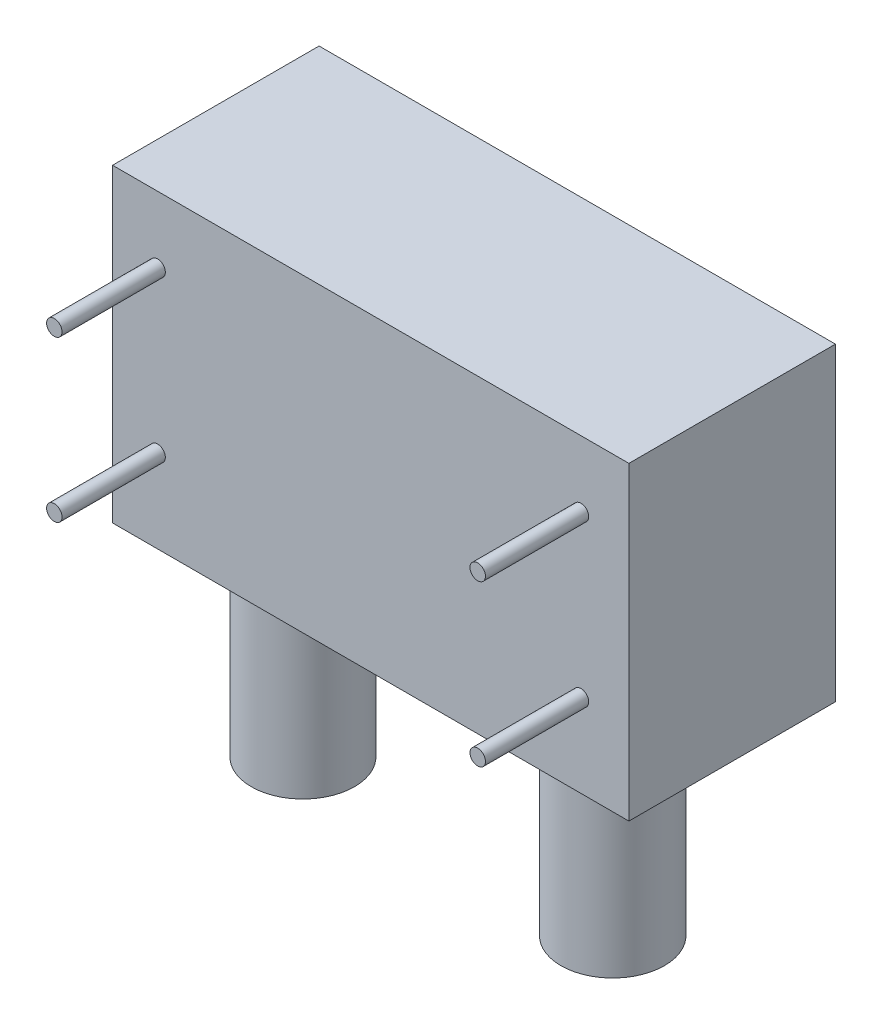
from build123d import *

# Parameters (mm, degrees)
SKETCH1_W           = 50
SKETCH1_H           = 30
BOSS_EXTRUDE1_DEPTH = 20
SKETCH2_R           = 5
SKETCH2_R_2         = 5.015568952
BOSS_EXTRUDE3_DEPTH = 20
SKETCH3_R           = 0.75
BOSS_EXTRUDE4_DEPTH = 10


with BuildPart() as part:
    # Sketch1 → Boss-Extrude1 (new body)
    with BuildSketch(Plane.XY):
        with Locations((-92.348484848, 31.333080808)):
            Rectangle(SKETCH1_W, SKETCH1_H)
    extrude(amount=BOSS_EXTRUDE1_DEPTH)

    # Sketch2 → Boss-Extrude3 (add)
    with BuildSketch(Plane.XZ.offset(-16.333080808)):
        with Locations(Location((-108.512795062, 10.404107755, 0), (0, 0, 90))):
            Circle(SKETCH2_R)
        with Locations(Location((-78.512795062, 10.404107755, 0), (0, 0, 90))):
            Circle(SKETCH2_R_2)
    extrude(amount=BOSS_EXTRUDE3_DEPTH)

    # Sketch3 → Boss-Extrude4 (add)
    with BuildSketch(Plane.XY.offset(20)):
        with Locations((-112.98809036, 39.90814541)):
            Circle(SKETCH3_R)
        with Locations((-71.988091026, 39.915535227)):
            Circle(SKETCH3_R)
        with Locations(Location((-71.988091026, 24.378479398, 0), (0, 0, 180))):
            Circle(SKETCH3_R)
        with Locations(Location((-112.98809036, 24.385869214, 0), (0, 0, 180))):
            Circle(SKETCH3_R)
    extrude(amount=BOSS_EXTRUDE4_DEPTH)


solid = part.part
